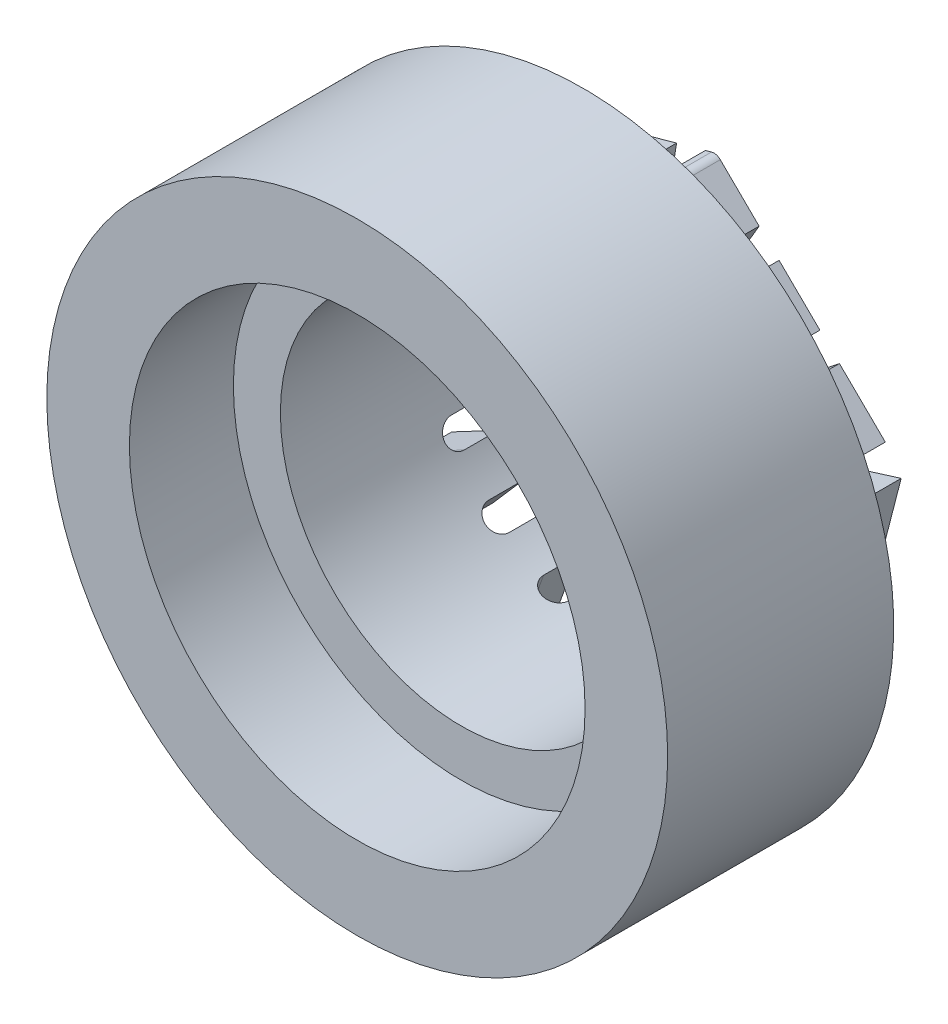
from build123d import *

# Parameters (mm, degrees)
SKETCH1_R           = 21.79955
BOSS_EXTRUDE1_DEPTH = 20.6502
SKETCH2_R           = 12.7
CUT_EXTRUDE1_DEPTH  = 20.6502
SKETCH3_R           = 16.000000004
CUT_EXTRUDE2_DEPTH  = 7.3025
SKETCH4_OUTSIDE_W   = 58.604
SKETCH4_OUTSIDE_H   = 58.604
CUT_EXTRUDE3_DEPTH  = 4.7752
CUT_EXTRUDE4_DEPTH  = 9.8552
CIRPATTERN1_COUNT   = 17
FILLET1_R           = 0.635


with BuildPart() as part:
    # Sketch1 → Boss-Extrude1 (new body)
    with BuildSketch(Plane.XY):
        Circle(SKETCH1_R)
    extrude(amount=BOSS_EXTRUDE1_DEPTH)

    # Sketch2 → Cut-Extrude1 (cut)
    with BuildSketch(Plane.XY.offset(20.6502)):
        Circle(SKETCH2_R)
    extrude(amount=-CUT_EXTRUDE1_DEPTH, mode=Mode.SUBTRACT)

    # Sketch3 → Cut-Extrude2 (cut)
    with BuildSketch(Plane.XY.offset(20.6502)):
        Circle(SKETCH3_R)
    extrude(amount=-CUT_EXTRUDE2_DEPTH, mode=Mode.SUBTRACT)

    # Sketch4 outside → Cut-Extrude3 (cut)
    with BuildSketch(Plane(origin=(0, 0, 0), x_dir=(-1, 0, 0), z_dir=(0, 0, -1))):
        Rectangle(SKETCH4_OUTSIDE_W, SKETCH4_OUTSIDE_H)
        Polygon((17.661795398, -4.907322758), (13.080763872, 12.841902112), (-4.581031526, 17.74922487), (-17.661795398, 4.907322758), (-13.080763872, -12.841902112), (4.581031526, -17.74922487), align=None, mode=Mode.SUBTRACT)
    extrude(amount=-CUT_EXTRUDE3_DEPTH, mode=Mode.SUBTRACT)

    # Sketch5 → Cut-Extrude4 (cut, symmetric)
    with BuildSketch(Plane(origin=(-15.371279635, 3.967289677, 0), x_dir=(0, 0, 1), z_dir=(-0.9682695833030739, 0.24990801117629627, 0))):
        with BuildLine():
            Line((2.3876, 0.9525), (0, 0.9525))
            Line((0, 0.9525), (0, -0.9525))
            Line((0, -0.9525), (2.3876, -0.9525))
            ThreePointArc((2.3876, -0.9525), (3.3401, 0), (2.3876, 0.9525))
        make_face()
    cut_extrude4 = extrude(amount=CUT_EXTRUDE4_DEPTH, both=True, mode=Mode.SUBTRACT)

    # CirPattern1: Cut-Extrude4 ×17 about axis
    cirpattern1_axis = Axis((0, 0, 13.3477), (0, 0, 1))
    for i in range(1, CIRPATTERN1_COUNT):
        add(cut_extrude4.rotate(cirpattern1_axis, i * 360 / CIRPATTERN1_COUNT), mode=Mode.SUBTRACT)

    # Fillet1
    fillet1_edges = [part.edges().sort_by_distance(p)[0] for p in [
        (-17.661795398, -4.907322758, 2.3876),
        (-13.080763872, 12.841902112, 2.3876),
        (4.581031526, 17.74922487, 2.3876),
        (17.661795398, 4.907322758, 3.964999961),
        (13.080763872, -12.841902112, 3.964999961),
        (-4.581031526, -17.74922487, 2.3876),
    ]]
    fillet(fillet1_edges, radius=FILLET1_R)


solid = part.part
